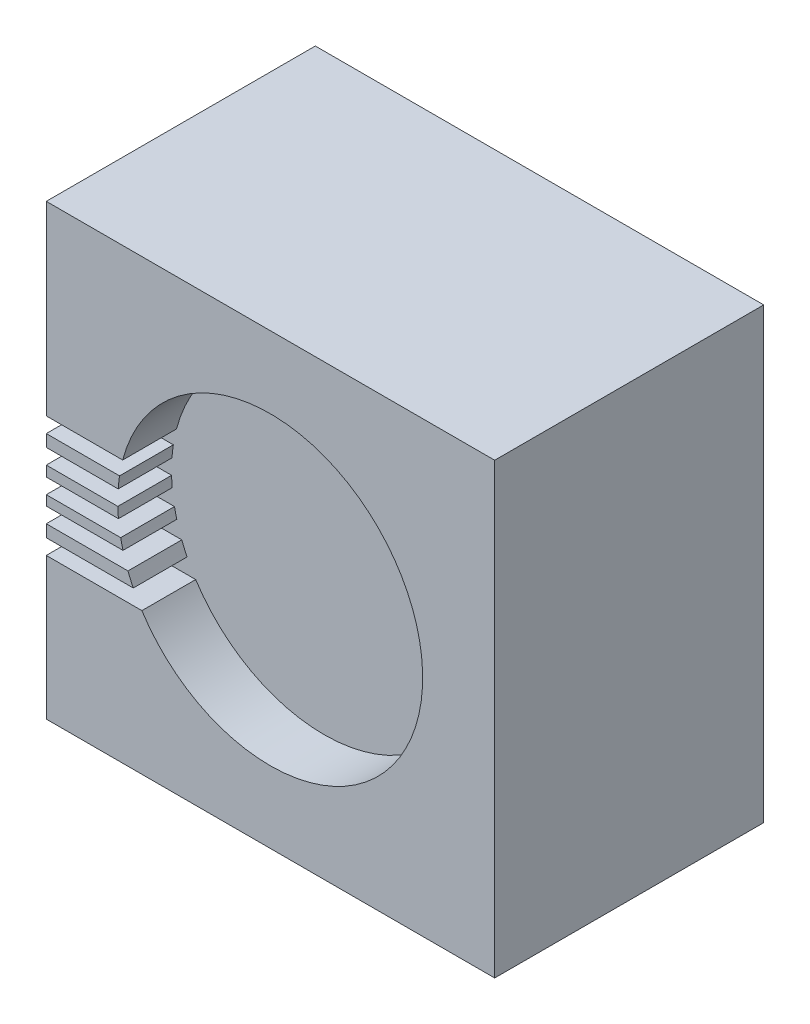
from build123d import *

# Parameters (mm, degrees)
SKETCH5_W           = 25
SKETCH5_H           = 25
BOSS_EXTRUDE3_DEPTH = 15
SKETCH6_R           = 8.5
SKETCH6_W           = 4.441456536
SKETCH6_H           = 0.851518301
SKETCH6_W_2         = 4.412060549
SKETCH6_H_2         = 0.8515183
SKETCH6_W_3         = 4.475416112
SKETCH6_W_4         = 4.837812326
SKETCH6_W_5         = 5.604508377
CUT_EXTRUDE3_DEPTH  = 3


with BuildPart() as part:
    # Sketch5 → Boss-Extrude3 (new body)
    with BuildSketch(Plane.XY):
        with Locations((0.01465692, 0.007301744)):
            Rectangle(SKETCH5_W, SKETCH5_H)
    extrude(amount=BOSS_EXTRUDE3_DEPTH)

    # Sketch6 → Cut-Extrude3 (cut)
    with BuildSketch(Plane.XY.offset(15)):
        Circle(SKETCH6_R)
        with Locations((-10.445228229, 1.72077303)):
            Rectangle(SKETCH6_W, SKETCH6_H)
        with Locations((-10.459926223, 0.199178628)):
            Rectangle(SKETCH6_W_2, SKETCH6_H_2)
        with Locations((-10.451337758, -1.230194922)):
            Rectangle(SKETCH6_W_3, SKETCH6_H_2)
        with Locations((-10.270139651, -2.633825362)):
            Rectangle(SKETCH6_W_4, SKETCH6_H)
        with Locations((-9.909880943, -4.16280996)):
            Rectangle(SKETCH6_W_5, SKETCH6_H)
    extrude(amount=-CUT_EXTRUDE3_DEPTH, mode=Mode.SUBTRACT)


solid = part.part
